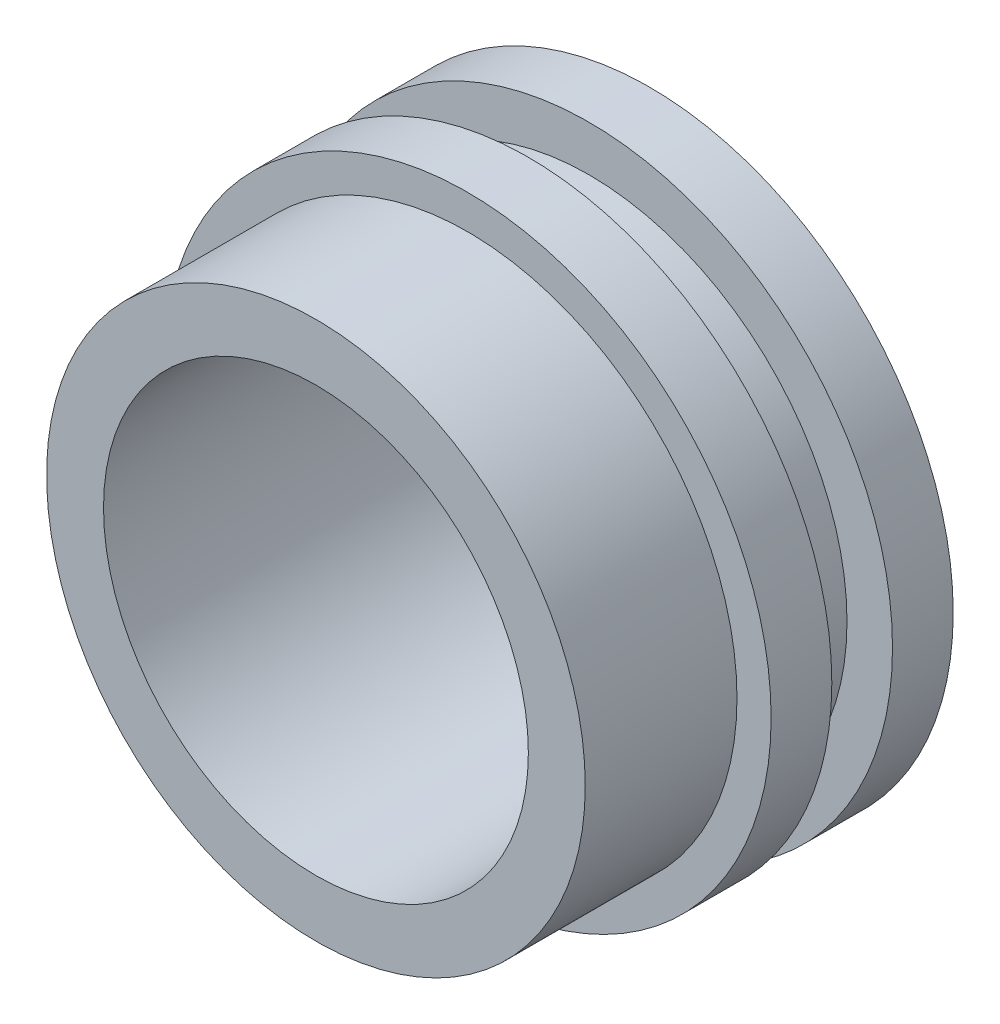
from build123d import *

# Parameters (mm, degrees)
SKETCH1_R           = 10
BOSS_EXTRUDE1_DEPTH = 2
SKETCH2_R           = 8.5
BOSS_EXTRUDE2_DEPTH = 6
BOSS_EXTRUDE3_START = 4
SKETCH3_R           = 10
BOSS_EXTRUDE3_DEPTH = 2
SKETCH5_R           = 7
CUT_EXTRUDE2_DEPTH  = 16.362291496
BOSS_EXTRUDE4_START = 6
SKETCH6_R           = 8.875
SKETCH6_R_2         = 7
BOSS_EXTRUDE4_DEPTH = 5


with BuildPart() as part:
    # Sketch1 → Boss-Extrude1 (new body)
    with BuildSketch(Plane.XY):
        Circle(SKETCH1_R)
    extrude(amount=BOSS_EXTRUDE1_DEPTH)

    # Sketch2 → Boss-Extrude2 (add)
    with BuildSketch(Plane.XY):
        Circle(SKETCH2_R)
    extrude(amount=BOSS_EXTRUDE2_DEPTH)

    # Sketch3 → Boss-Extrude3 (add)
    with BuildSketch(Plane.XY.offset(BOSS_EXTRUDE3_START)):
        Circle(SKETCH3_R)
    extrude(amount=BOSS_EXTRUDE3_DEPTH)

    # Sketch5 → Cut-Extrude2 (cut, through all)
    with BuildSketch(Plane.XY):
        Circle(SKETCH5_R)
    extrude(amount=CUT_EXTRUDE2_DEPTH, mode=Mode.SUBTRACT)

    # Sketch6 → Boss-Extrude4 (add)
    with BuildSketch(Plane.XY.offset(BOSS_EXTRUDE4_START)):
        Circle(SKETCH6_R)
        Circle(SKETCH6_R_2, mode=Mode.SUBTRACT)
    extrude(amount=BOSS_EXTRUDE4_DEPTH)


solid = part.part
